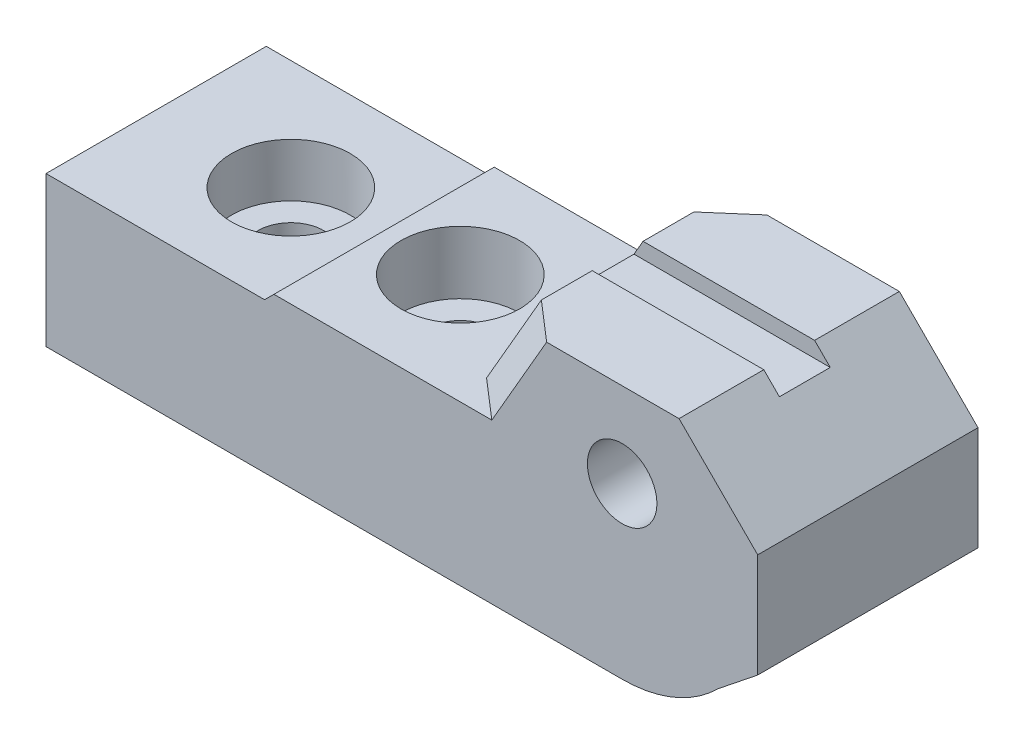
from build123d import *

# Parameters (mm, degrees)
SKETCH_1_R          = 2.05
EXTRUDE_1_DEPTH     = 6.5
SKETCH_2_R          = 1.925
CUT_EXTRUDE_1_DEPTH = 46.069390943
SKETCH_4_R          = 3.5
CUT_EXTRUDE_3_DEPTH = 3.7
SKETCH_5_W          = 18.309146901
SKETCH_5_H          = 4.198551417
CUT_EXTRUDE_4_DEPTH = 1.5
CHAMFER_1_SIZE      = 2


with BuildPart() as part:
    # 스케치1 → 보스-돌출1 (new, symmetric)
    with BuildSketch(Plane.XY):
        with BuildLine():
            Line((24, 9.4), (27.233161507, 15))
            Line((27.233161507, 15), (37.358175691, 15))
            Line((37.358175691, 15), (42, 10.358175691))
            Line((42, 10.358175691), (42, 8))
            Line((42, 8), (42, 4.214621821))
            Line((42, 4.214621821), (39.656854249, 2.343145751))
            ThreePointArc((39.656854249, 2.343145751), (37.061467459, 0.60896374), (34, 0))
            Line((34, 0), (0, 0))
            Line((0, 0), (0, 8.847038924))
            Line((0, 8.847038924), (12.898784487, 8.847038924))
            Line((12.898784487, 8.847038924), (13.451745563, 9.4))
            Line((13.451745563, 9.4), (24, 9.4))
        make_face()
        with Locations(Location((34, 10, 0), (0, 0, 180))):
            Circle(SKETCH_1_R, mode=Mode.SUBTRACT)
    extrude(amount=EXTRUDE_1_DEPTH, both=True)

    # 스케치2 → 컷-돌출1 (cut, through all)
    with BuildSketch(Plane(origin=(0, 0, 0), x_dir=(1, 0, 0), z_dir=(0, 1, 0))):
        with Locations(Location((7.95, 0, 0), (0, 0, 90))):
            Circle(SKETCH_2_R)
        with Locations((17.95, 0)):
            Circle(SKETCH_2_R)
    extrude(amount=CUT_EXTRUDE_1_DEPTH, mode=Mode.SUBTRACT)

    # 스케치4 → 컷-돌출3 (cut)
    with BuildSketch(Plane(origin=(0, 9.4, 0), x_dir=(1, 0, 0), z_dir=(0, 1, 0))):
        with Locations(Location((7.95, 0, 0), (0, 0, 270))):
            Circle(SKETCH_4_R)
        with Locations(Location((17.95, 0, 0), (0, 0, 270))):
            Circle(SKETCH_4_R)
    extrude(amount=-CUT_EXTRUDE_3_DEPTH, mode=Mode.SUBTRACT)

    # 스케치5 → 컷-돌출4 (cut, symmetric)
    with BuildSketch(Plane.XY):
        with Locations((31.708331529, 16.176346462)):
            Rectangle(SKETCH_5_W, SKETCH_5_H)
    extrude(amount=CUT_EXTRUDE_4_DEPTH, both=True, mode=Mode.SUBTRACT)

    # 모따기1
    chamfer_1_edges = [part.edges().sort_by_distance(p)[0] for p in [
        (25.616580754, 12.2, -6.5),
        (25.616580754, 12.2, 6.5),
    ]]
    chamfer(chamfer_1_edges, length=CHAMFER_1_SIZE)


solid = part.part
